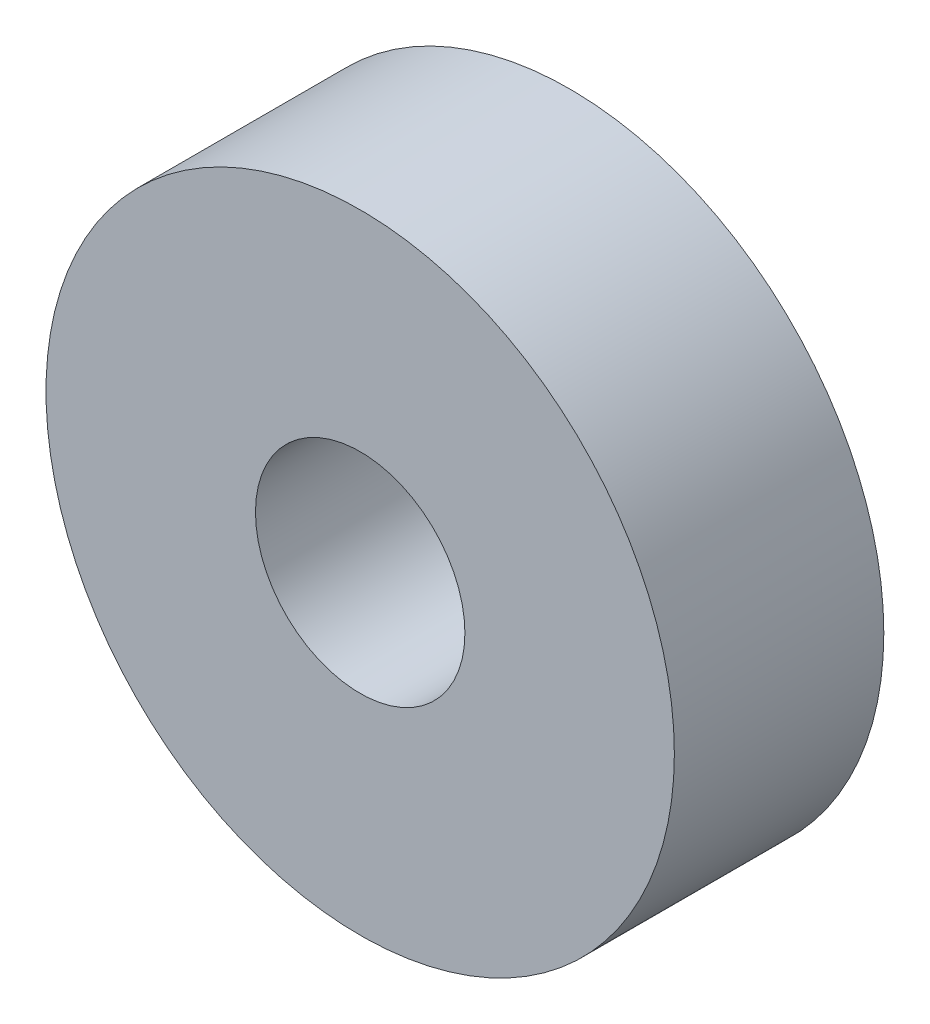
from build123d import *

# Parameters (mm, degrees)
MODEL_R                 = 4.5
MODEL_R_2               = 1.5
SALIENTE_EXTRUIR1_DEPTH = 3


with BuildPart() as part:
    # Model → Saliente-Extruir1 (new body)
    with BuildSketch(Plane.XY):
        with Locations((115.485593985, 217.537062318)):
            Circle(MODEL_R)
        with Locations((115.485593985, 217.537062318)):
            Circle(MODEL_R_2, mode=Mode.SUBTRACT)
    extrude(amount=SALIENTE_EXTRUIR1_DEPTH)


solid = part.part
